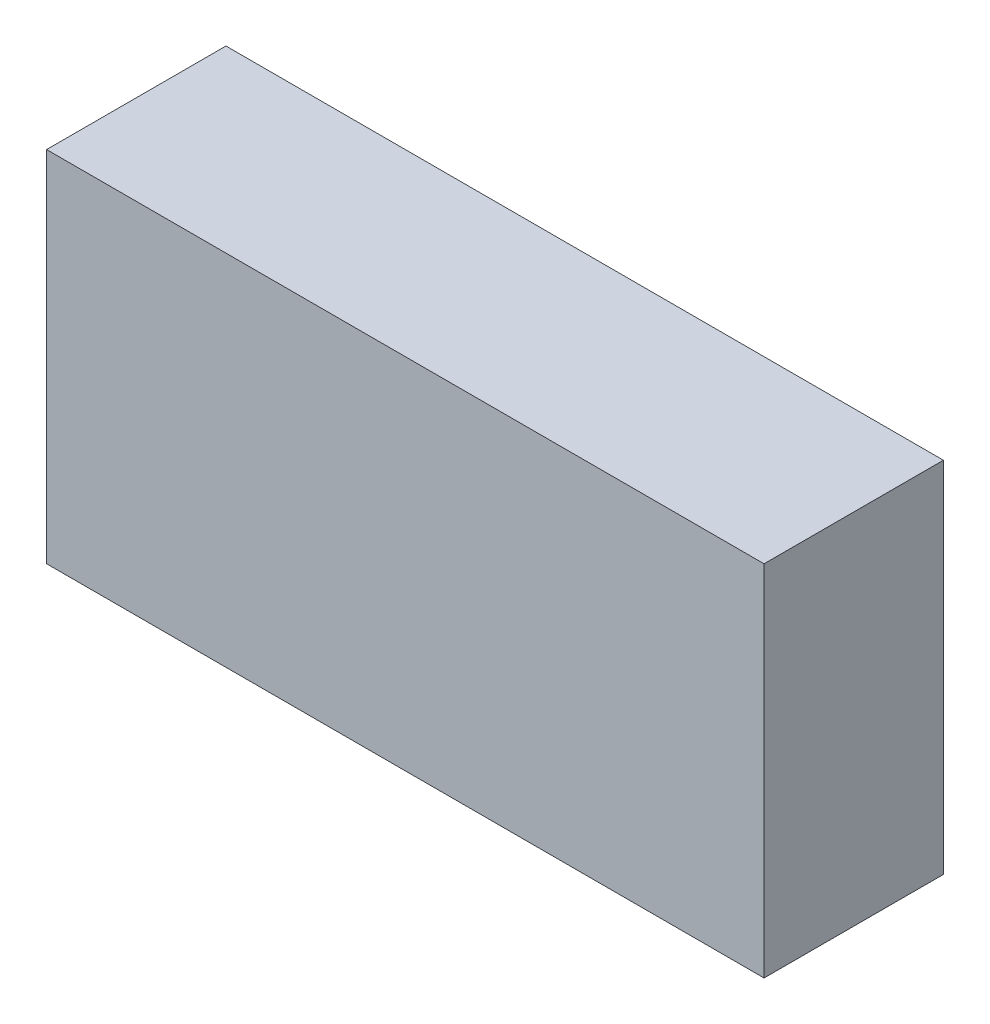
from build123d import *

# Parameters (mm, degrees)
SKETCH1_W           = 20
SKETCH1_H           = 10
BOSS_EXTRUDE1_DEPTH = 5


with BuildPart() as part:
    # Sketch1 → Boss-Extrude1 (new body)
    with BuildSketch(Plane.XY):
        with Locations((10, 5)):
            Rectangle(SKETCH1_W, SKETCH1_H)
    extrude(amount=BOSS_EXTRUDE1_DEPTH)


solid = part.part
